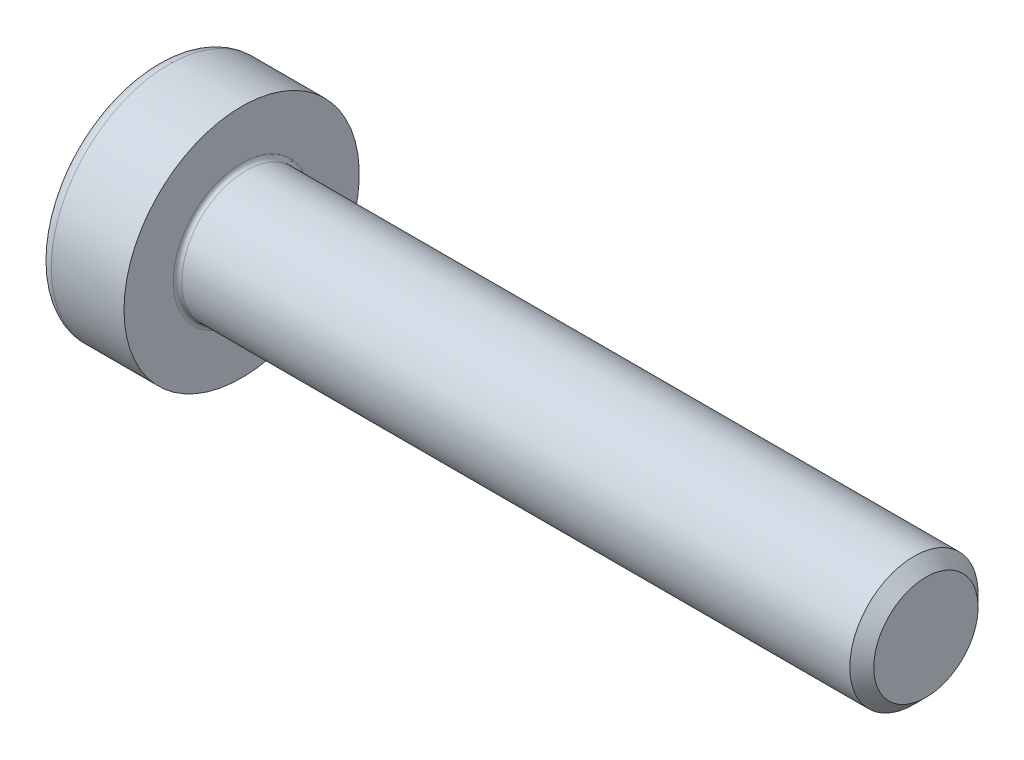
from build123d import *

# Parameters (mm, degrees)
FILLET1_R   = 0.1
FILLET2_R   = 0.3
HEX_2_DEPTH = 1.5


with BuildPart() as part:
    # BodySke → Base-Revolve (revolve)
    with BuildSketch(Plane.XY, mode=Mode.PRIVATE) as base_revolve_sk:
        Polygon((0, 0), (0, 2.75), (2, 2.75), (2, 1.5), (17.7195, 1.5), (18, 1.2195), (18, 0), align=None)
    revolve(base_revolve_sk.sketch.rotate(Axis((-31.75, 0, 0), (1, 0, 0)), 90), axis=Axis((-31.75, 0, 0), (1, 0, 0)))

    # Fillet1
    fillet1_edges = [part.edges().sort_by_distance(p)[0] for p in [
        (2, 0, -1.5),
    ]]
    fillet(fillet1_edges, radius=FILLET1_R)

    # Fillet2
    fillet2_edges = [part.edges().sort_by_distance(p)[0] for p in [
        (0, 0, -2.75),
    ]]
    fillet(fillet2_edges, radius=FILLET2_R)

    # Sketch2 → Hex-PreBroach (revolve, cut)
    with BuildSketch(Plane.XY, mode=Mode.PRIVATE) as hex_prebroach_sk:
        Polygon((0, 1), (1.5, 1), (2.077350269, 0), (0, 0), align=None)
    revolve(hex_prebroach_sk.sketch.rotate(Axis((0, 0, 0), (1, 0, 0)), 90), axis=Axis((0, 0, 0), (1, 0, 0)), mode=Mode.SUBTRACT)

    # Sketch3 → Hex 2 (cut)
    with BuildSketch(Plane(origin=(0, 0, 0), x_dir=(0, 0.500000000000001, 0.866025403784438), z_dir=(-1, 0, 0))):
        Polygon((0.577350269, 1), (-0.577350269, 1), (-1.154700538, 0), (-0.577350269, -1), (0.577350269, -1), (1.154700538, 0), align=None)
    extrude(amount=-HEX_2_DEPTH, mode=Mode.SUBTRACT)


solid = part.part
